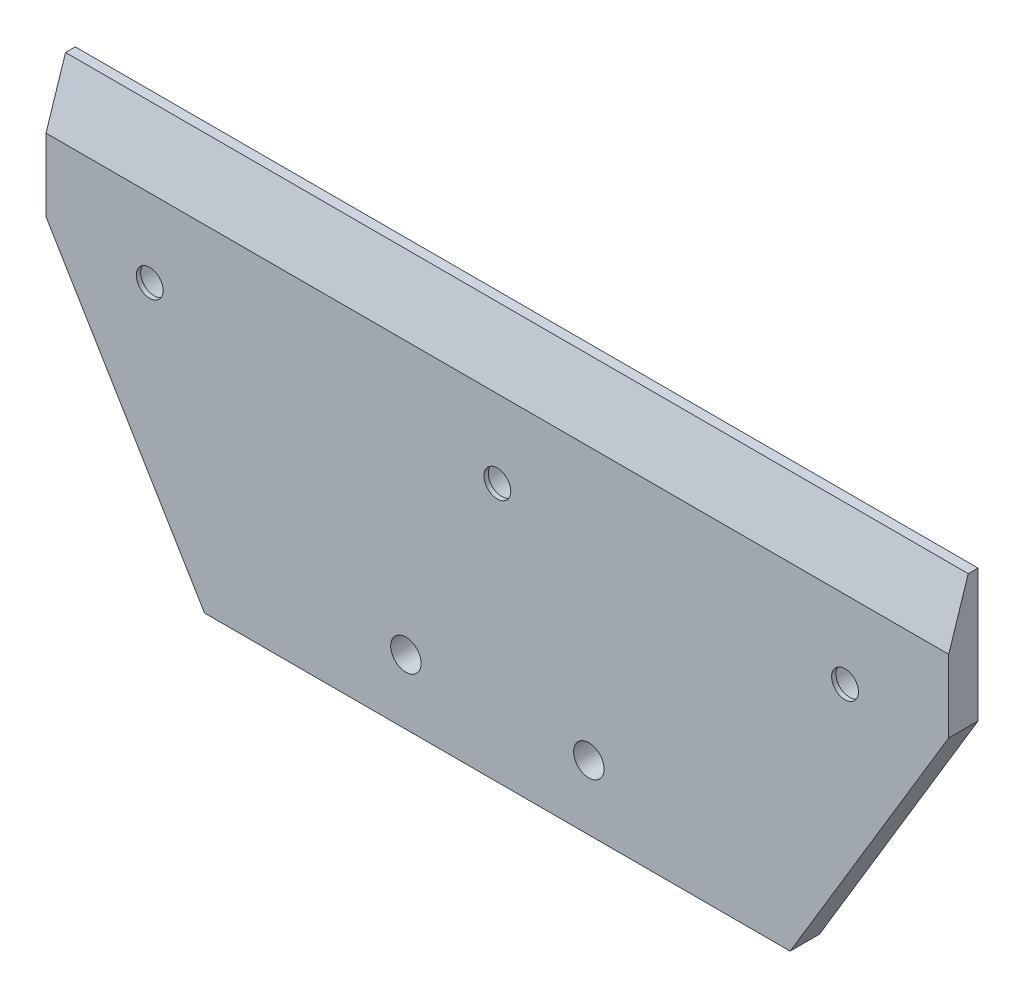
from build123d import *

# Parameters (mm, degrees)
BOSS_EXTRUDE1_DEPTH            = 1.2
CUT_EXTRUDE1_DEPTH             = 81.831243959
F_2_5_2_5_DIAMETER_HOLE1_D     = 2.5
F_2_5_2_5_DIAMETER_HOLE1_DEPTH = 10
F_2_5_2_5_DIAMETER_HOLE1_TIP   = 0.751075774
HOLEWZD1_AT_2_COUNT            = 2
HOLEWZD1_AT_2_PITCH            = 28.5
HOLEWZD1_AT_3_COUNT            = 2
HOLEWZD1_AT_3_PITCH            = 57


with BuildPart() as part:
    # Sketch1 → Boss-Extrude1 (new, symmetric)
    with BuildSketch(Plane.XY):
        Polygon((-24, 0), (24, 0), (37, 21.635633271), (37, 32.5), (-37, 32.5), (-37, 21.635633271), align=None)
    extrude(amount=BOSS_EXTRUDE1_DEPTH, both=True)

    # Sketch2 → Cut-Extrude1 (cut, through all)
    with BuildSketch(Plane(origin=(37, 0, 0), x_dir=(0, 0, -1), z_dir=(1, 0, 0))):
        Polygon((-1.2, 27.575706341), (0.4, 32.5), (-1.2, 32.5), align=None)
    extrude(amount=-CUT_EXTRUDE1_DEPTH, mode=Mode.SUBTRACT)

    # Ø2.5 (2.5) Diameter Hole1
    with Locations(Plane.XY.offset(1.2)):
        with Locations((-7.5, 5.3), (7.5, 5.3)):
            Hole(F_2_5_2_5_DIAMETER_HOLE1_D / 2, depth=F_2_5_2_5_DIAMETER_HOLE1_DEPTH)
            with Locations((0, 0, -(F_2_5_2_5_DIAMETER_HOLE1_DEPTH + F_2_5_2_5_DIAMETER_HOLE1_TIP / 2))):  # 118° drill point
                Cone(0, F_2_5_2_5_DIAMETER_HOLE1_D / 2, F_2_5_2_5_DIAMETER_HOLE1_TIP, mode=Mode.SUBTRACT)

    # Sketch10 → HoleWzd1 (revolve, cut)
    with BuildSketch(Plane(origin=(28.5, 21.2, -1.2), x_dir=(0, 1, 0), z_dir=(1, 0, 0))):
        Polygon((0, 0), (0, 2.4), (1.1, 2.4), (1.1, 2.040774557), (2, 1.5), (2, 0), align=None)
    holewzd1 = revolve(axis=Axis((28.5, 21.2, -7.330023899), (0, 0, 1)), mode=Mode.SUBTRACT)

    # HoleWzd1 at 2: HoleWzd1 ×2
    with Locations(*[(-i * HOLEWZD1_AT_2_PITCH, 0, 0) for i in range(1, HOLEWZD1_AT_2_COUNT)]):
        add(holewzd1, mode=Mode.SUBTRACT)

    # HoleWzd1 at 3: HoleWzd1 ×2
    with Locations(*[(-i * HOLEWZD1_AT_3_PITCH, 0, 0) for i in range(1, HOLEWZD1_AT_3_COUNT)]):
        add(holewzd1, mode=Mode.SUBTRACT)


solid = part.part
